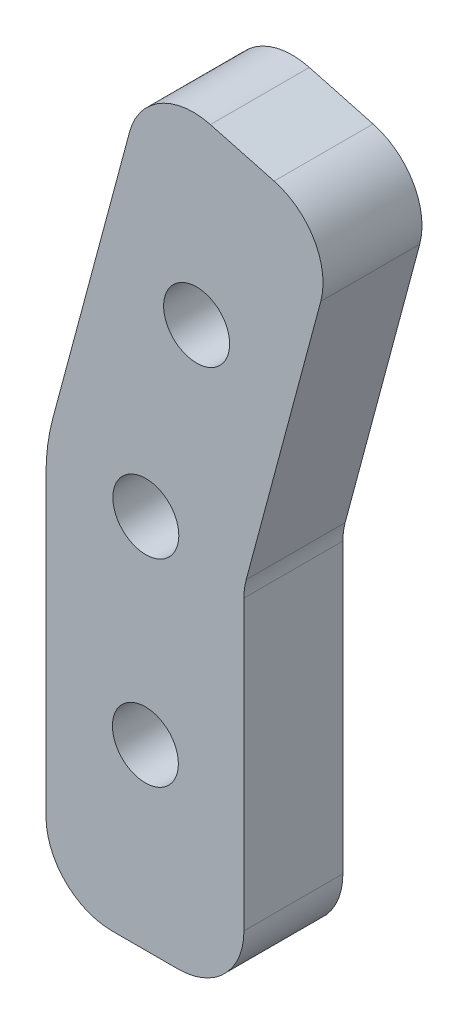
from build123d import *

# Parameters (mm, degrees)
SKETCH1_W                   = 19.05
SKETCH1_H                   = 34.925
BOSS_EXTRUDE1_DEPTH         = 4.7625
BOSS_EXTRUDE2_DEPTH         = 9.525
BOSS_EXTRUDE3_DEPTH         = 9.525
F_1_4_0_25_DIAMETER_HOLE1_D = 6.35
FILLET1_R                   = 6.35


with BuildPart() as part:
    # Sketch1 → Boss-Extrude1 (new, symmetric)
    with BuildSketch(Plane.XY):
        Rectangle(SKETCH1_W, SKETCH1_H)
    extrude(amount=BOSS_EXTRUDE1_DEPTH, both=True)



with BuildPart() as body_2:
    # Sketch2 → Boss-Extrude2 (new body)
    with BuildSketch(Plane.XY.offset(4.7625)):
        Polygon((9.525, 17.4625), (18.56425515, 51.197459483), (0.163368159, 56.127962292), (-8.875886991, 22.393002809), align=None)
    extrude(amount=-BOSS_EXTRUDE2_DEPTH)


with BuildPart() as part_1:
    add(part.part)

    add(body_2.part)  # Boss-Extrude3 merges body 2
    # Sketch3 → Boss-Extrude3 (add)
    with BuildSketch(Plane.XY.offset(4.7625)):
        with BuildLine():
            Line((-8.875886991, 22.393002809), (9.525, 17.4625))
            Line((9.525, 17.4625), (-9.525, 17.4625))
            ThreePointArc((-9.525, 17.4625), (-9.362024609, 19.949023962), (-8.875886991, 22.393002809))
        make_face()
    extrude(amount=-BOSS_EXTRUDE3_DEPTH)

    # 1/4 (0.25) Diameter Hole1 (through all)
    with Locations(Plane.XY.offset(4.7625)):
        with Locations((0.038567729, -0.344238019), (0.081487695, 18.705761981), (4.970520592, 37.117710746)):
            Hole(F_1_4_0_25_DIAMETER_HOLE1_D / 2)

    # Fillet1
    fillet1_edges = [part_1.edges().sort_by_distance(p)[0] for p in [
        (18.56425515, 51.197459483, 0),
        (0.163368159, 56.127962292, 0),
        (9.525, -17.4625, 0),
        (-9.525, -17.4625, 0),
        (9.525, 17.4625, 0),
    ]]
    fillet(fillet1_edges, radius=FILLET1_R)


solid = part_1.part
